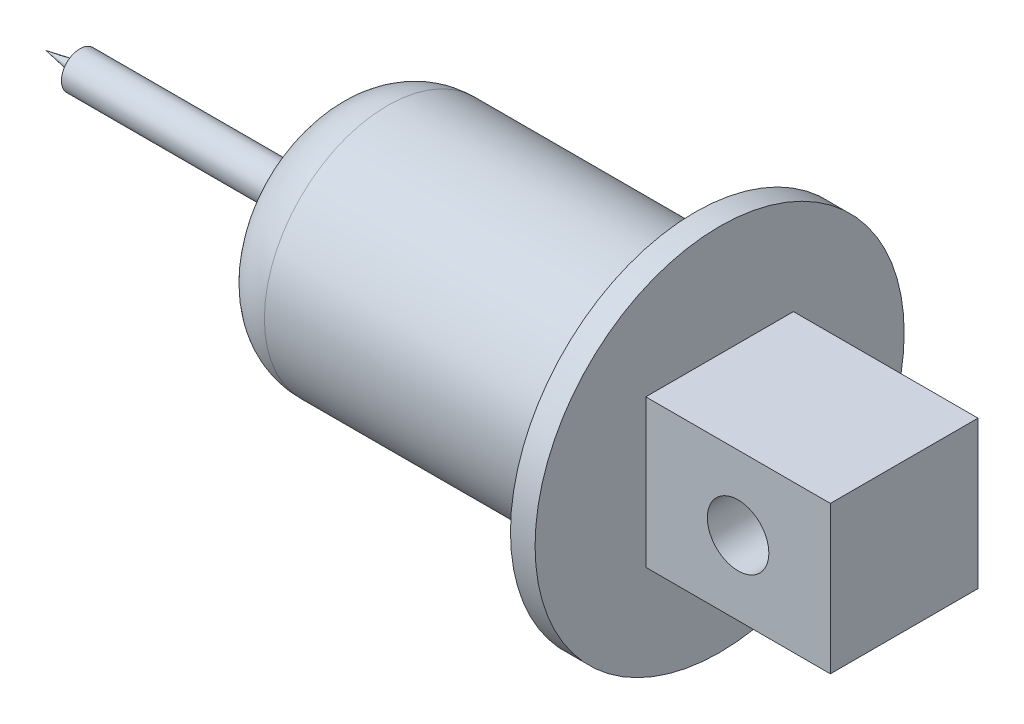
from build123d import *

# Parameters (mm, degrees)
SKETCH1_R             = 15
BOSS_EXTRUDE1_DEPTH   = 2
SKETCH2_W             = 12
SKETCH2_H             = 12
BOSS_EXTRUDE2_DEPTH   = 15
SKETCH3_R             = 2.5
CUT_EXTRUDE1_DEPTH    = 30.849623113
SKETCH4_R             = 10
BOSS_EXTRUDE3_DEPTH   = 30
FILLET1_R             = 5
SKETCH5_R             = 1.5
BOSS_EXTRUDE4_DEPTH   = 20
SKETCH7_R             = 0.5
BODY_MOVE_COPY2_ANGLE = 90


with BuildPart() as part:
    # Sketch1 → Boss-Extrude1 (new body)
    with BuildSketch(Plane.XY):
        Circle(SKETCH1_R)
    extrude(amount=-BOSS_EXTRUDE1_DEPTH)

    # Sketch2 → Boss-Extrude2 (add)
    with BuildSketch(Plane.XY):
        Rectangle(SKETCH2_W, SKETCH2_H)
    extrude(amount=BOSS_EXTRUDE2_DEPTH)

    # Sketch3 → Cut-Extrude1 (cut, through all)
    with BuildSketch(Plane(origin=(6, 0, 0), x_dir=(0, 0, -1), z_dir=(1, 0, 0))):
        with Locations(Location((-7.5, 0, 0), (0, 0, 90))):
            Circle(SKETCH3_R)
    extrude(amount=-CUT_EXTRUDE1_DEPTH, mode=Mode.SUBTRACT)

    # Sketch4 → Boss-Extrude3 (add)
    with BuildSketch(Plane(origin=(0, 0, -2), x_dir=(-1, 0, 0), z_dir=(0, 0, -1))):
        with Locations(Location((0, 0, 0), (0, 0, 180))):
            Circle(SKETCH4_R)
    extrude(amount=BOSS_EXTRUDE3_DEPTH)

    # Fillet1
    fillet1_edges = [part.edges().sort_by_distance(p)[0] for p in [
        (-10, 0, -32),
    ]]
    fillet(fillet1_edges, radius=FILLET1_R)

    # Sketch5 → Boss-Extrude4 (add)
    with BuildSketch(Plane(origin=(0, 0, -32), x_dir=(-1, 0, 0), z_dir=(0, 0, -1))):
        Circle(SKETCH5_R)
    extrude(amount=BOSS_EXTRUDE4_DEPTH)

    # Sketch7 → Loft2 section 0
    with BuildSketch(Plane(origin=(0, 0, -52), x_dir=(-1, 0, 0), z_dir=(0, 0, -1)), mode=Mode.PRIVATE) as loft2_s0:
        Circle(SKETCH7_R)
    loft([Vertex(0, 0, -54.75), loft2_s0.sketch])


with BuildPart() as part_1:
    # Body-Move/Copy1: moved
    add(part.part.moved(Location((0, 0, 52))))


with BuildPart() as part_2:
    # Body-Move/Copy2: moved
    add(part_1.part.rotate(Axis((0, 0, 0), (0, 1, 0)), BODY_MOVE_COPY2_ANGLE))


solid = part_2.part
